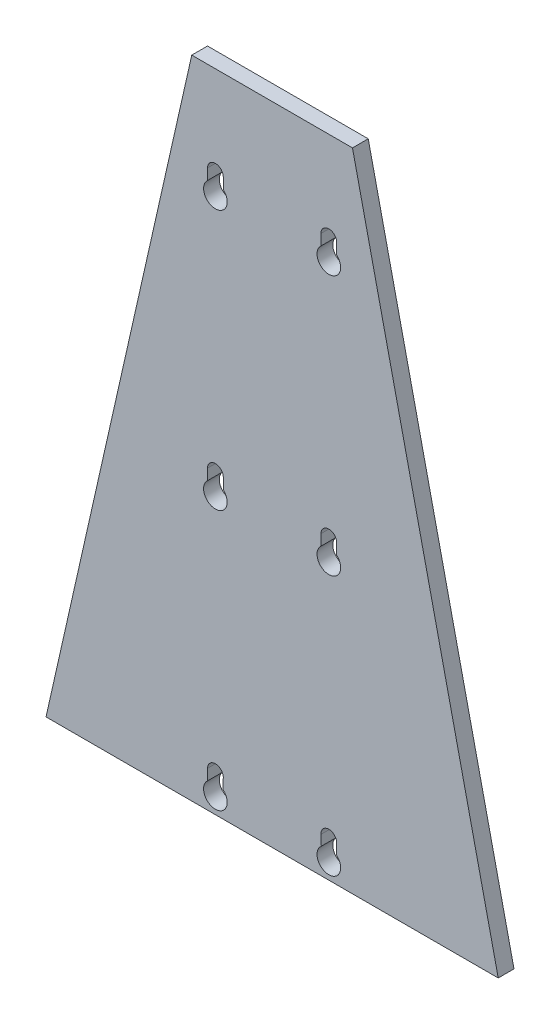
from build123d import *

# Parameters (mm, degrees)
EXTRUDE_1_DEPTH = 10


with BuildPart() as part:
    # 草图1 → 凸台-拉伸1 (new body)
    with BuildSketch(Plane.XY):
        Polygon((-51, 0), (-143.5, -410), (-36, -410), (143.5, -410), (51, 0), align=None)
        with BuildLine():
            ThreePointArc((-31.189754148, -393.74573768), (-28.949930235, -402.058616091), (-36, -407))
            ThreePointArc((-36, -407), (-43.006292692, -402.176165673), (-41, -393.909830056))
            Line((-41, -393.909830056), (-41, -387))
            ThreePointArc((-41, -387), (-35.859408171, -382.001976997), (-31.007906425, -387.281072477))
            Line((-31.007906425, -387.281072477), (-31.189754148, -393.74573768))
        make_face(mode=Mode.SUBTRACT)
        with BuildLine():
            Line((-41, -228.909830056), (-41, -222))
            ThreePointArc((-41, -222), (-36, -217), (-31, -222))
            Line((-31, -222), (-31, -228.909830056))
            ThreePointArc((-31, -228.909830056), (-36, -242), (-41, -228.909830056))
        make_face(mode=Mode.SUBTRACT)
        with BuildLine():
            Line((-41, -63.909830056), (-41, -57))
            ThreePointArc((-41, -57), (-36, -52), (-31, -57))
            Line((-31, -57), (-31, -63.909830056))
            ThreePointArc((-31, -63.909830056), (-36, -77), (-41, -63.909830056))
        make_face(mode=Mode.SUBTRACT)
        with BuildLine():
            Line((41, -57), (41, -63.909830056))
            ThreePointArc((41, -63.909830056), (36, -77), (31, -63.909830056))
            Line((31, -63.909830056), (31, -57))
            ThreePointArc((31, -57), (36, -52), (41, -57))
        make_face(mode=Mode.SUBTRACT)
        with BuildLine():
            Line((41, -387), (41, -393.909830056))
            ThreePointArc((41, -393.909830056), (35.874567803, -406.998951044), (31.189754148, -393.74573768))
            Line((31.189754148, -393.74573768), (31.007906425, -387.281072477))
            ThreePointArc((31.007906425, -387.281072477), (35.859408171, -382.001976997), (41, -387))
        make_face(mode=Mode.SUBTRACT)
        with BuildLine():
            Line((31, -228.909830056), (31, -222))
            ThreePointArc((31, -222), (36, -217), (41, -222))
            Line((41, -222), (41, -228.909830056))
            ThreePointArc((41, -228.909830056), (36, -242), (31, -228.909830056))
        make_face(mode=Mode.SUBTRACT)
    extrude(amount=EXTRUDE_1_DEPTH)


solid = part.part
